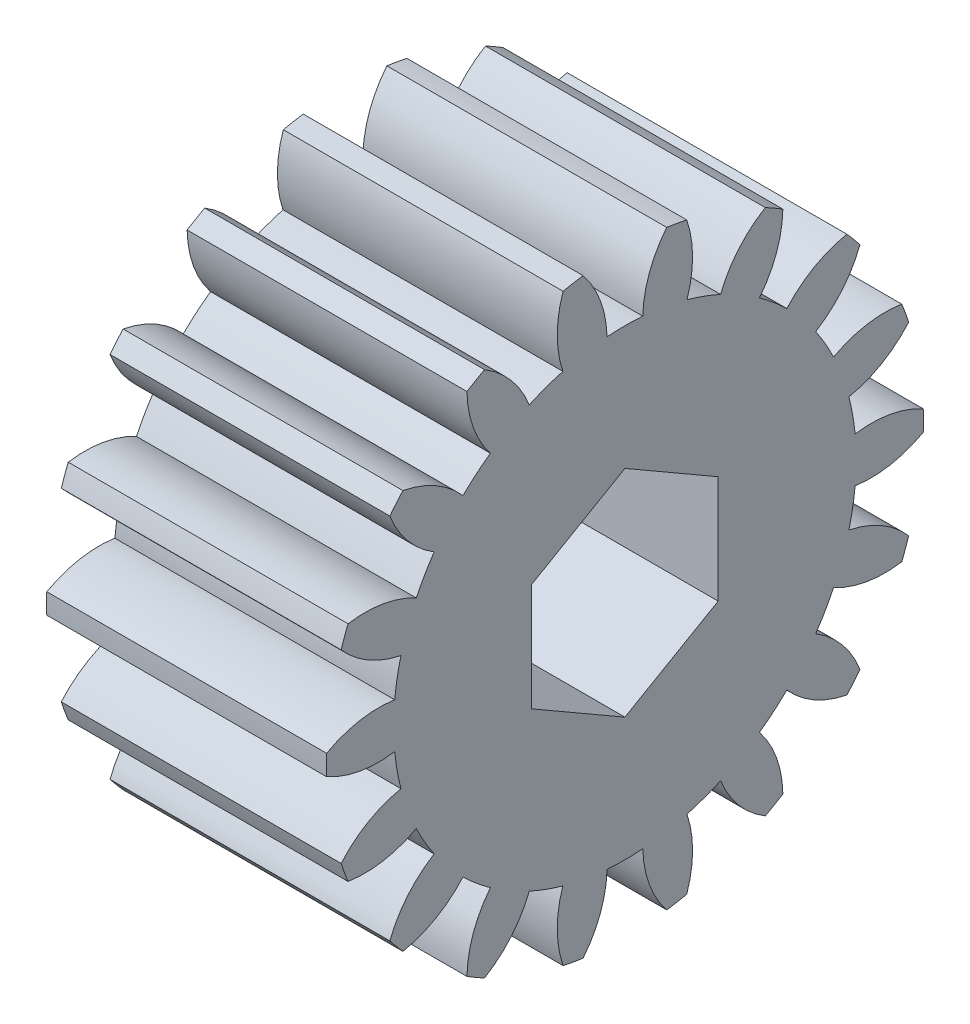
from build123d import *

# Parameters (mm, degrees)
BASPROSKE_W              = 7.5
BASPROSKE_H              = 8
TOOTHCUT_DEPTH           = 14.57387196
TEETHCUTS_COUNT          = 18
TEETHCUTS_ANGLE          = 340
BORSKE_R                 = 2.5
BORE_DEPTH               = 50.0000508
TAGLIO_ESTRUSIONE1_DEPTH = 10


with BuildPart() as part:
    # BasProSke → Base-Revolve (revolve)
    with BuildSketch(Plane(origin=(0, 0, 0), x_dir=(1, 0, 0), z_dir=(0, 1, 0)), mode=Mode.PRIVATE) as base_revolve_sk:
        with Locations((3.75, 4)):
            Rectangle(BASPROSKE_W, BASPROSKE_H)
    revolve(base_revolve_sk.sketch.rotate(Axis((-10, 0, 0), (1, 0, 0)), 180), axis=Axis((-10, 0, 0), (1, 0, 0)))

    # TooCutSke → ToothCut (cut, through all)
    with BuildSketch(Plane(origin=(0, 0, 0), x_dir=(0, 0, -1), z_dir=(1, 0, 0))):
        with BuildLine():
            ThreePointArc((0.478981505, 6.180467435), (0, 6.199), (-0.478981505, 6.180467435))
            ThreePointArc((-0.478981505, 6.180467435), (-0.660732846, 7.117783932), (-1.138936203, 7.944172045))
            ThreePointArc((-1.138936203, 7.944172045), (0, 8.0254), (1.138936203, 7.944172045))
            ThreePointArc((1.138936203, 7.944172045), (0.660732846, 7.117783932), (0.478981505, 6.180467435))
        make_face()
    toothcut = extrude(amount=TOOTHCUT_DEPTH, mode=Mode.SUBTRACT)

    # TeethCuts: ToothCut ×18 about axis
    teethcuts_axis = Axis((-10, 0, 0), (1, 0, 0))
    for i in range(1, TEETHCUTS_COUNT):
        add(toothcut.rotate(teethcuts_axis, i * TEETHCUTS_ANGLE / (TEETHCUTS_COUNT - 1)), mode=Mode.SUBTRACT)

    # BorSke → Bore (cut, symmetric)
    with BuildSketch(Plane(origin=(0, 0, 0), x_dir=(0, 0, -1), z_dir=(1, 0, 0))):
        with Locations(Location((0, 0, 0), (0, 0, 180))):
            Circle(BORSKE_R)
    extrude(amount=BORE_DEPTH, both=True, mode=Mode.SUBTRACT)

    # Schizzo2 → Taglio-Estrusione1 (cut)
    with BuildSketch(Plane(origin=(7.5, 0, 0), x_dir=(0, 0, -1), z_dir=(1, 0, 0))):
        Polygon((0, 2.886751346), (-2.5, 1.443375673), (-2.5, -1.443375673), (0, -2.886751346), (2.5, -1.443375673), (2.5, 1.443375673), align=None)
    extrude(amount=-TAGLIO_ESTRUSIONE1_DEPTH, mode=Mode.SUBTRACT)


solid = part.part
